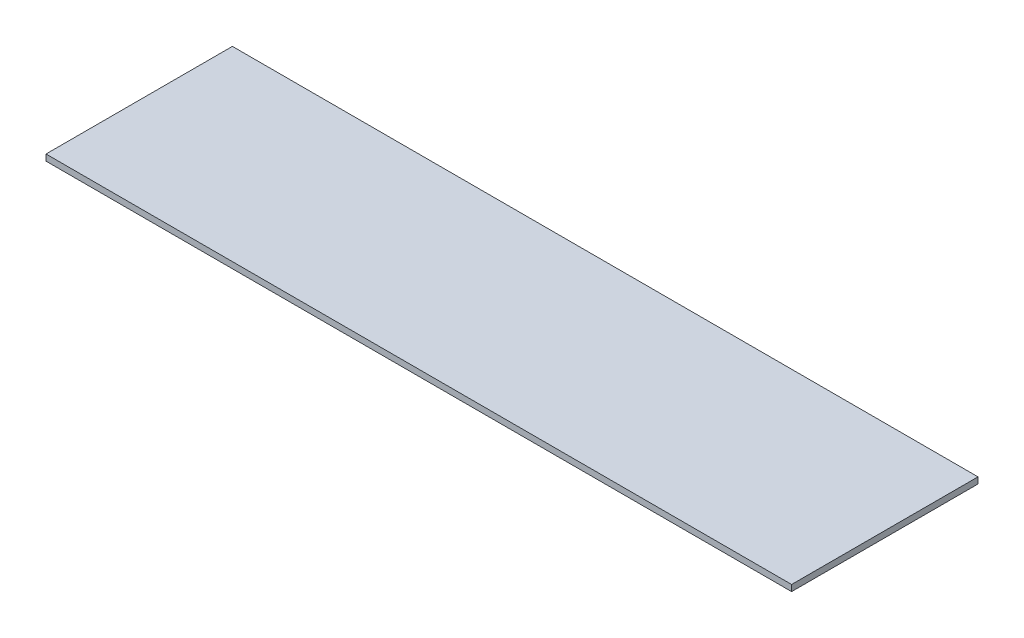
from build123d import *

# Parameters (mm, degrees)
SKETCH1_W           = 600
SKETCH1_H           = 150
BOSS_EXTRUDE1_DEPTH = 5


with BuildPart() as part:
    # Sketch1 → Boss-Extrude1 (new body)
    with BuildSketch(Plane(origin=(0, 0, 0), x_dir=(1, 0, 0), z_dir=(0, 1, 0))):
        Rectangle(SKETCH1_W, SKETCH1_H)
    extrude(amount=BOSS_EXTRUDE1_DEPTH)


solid = part.part
